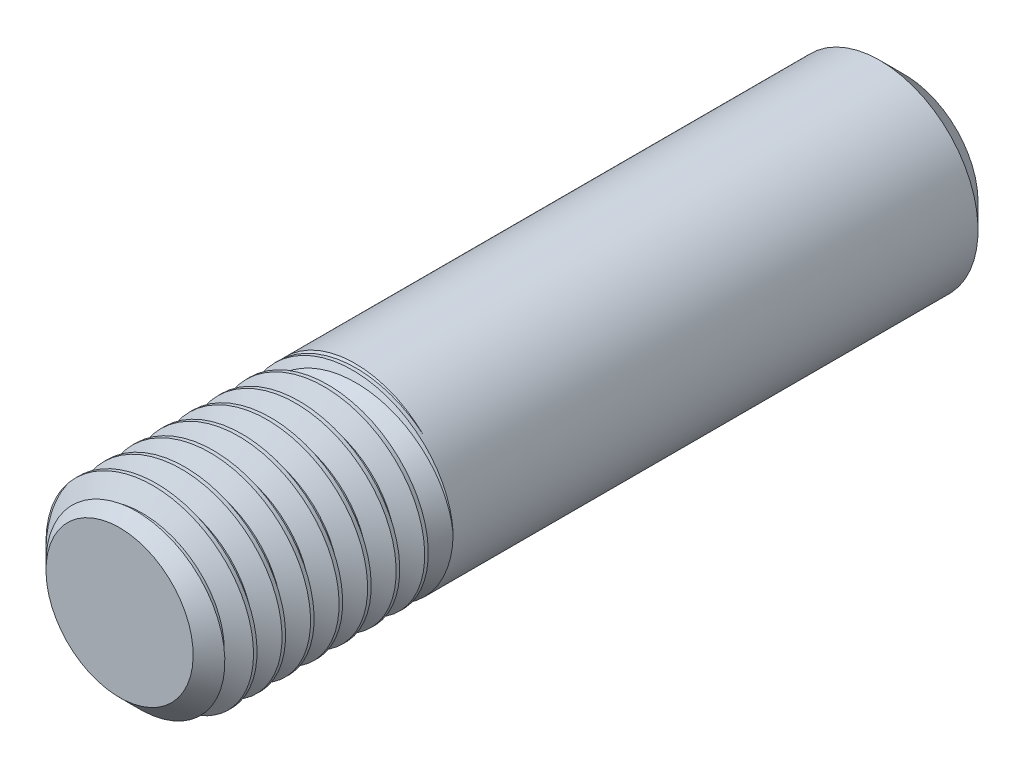
from build123d import *

# Parameters (mm, degrees)
CHAMFER1_SIZE          = 1.984375
CHAMFER2_SIZE          = 1.984375
CUT_SWEEP1_PITCH       = 2.309090909
CUT_SWEEP1_HEIGHT      = 21.359090909
CUT_SWEEP1_RADIUS      = 7.9375
CUT_SWEEP1_START_ANGLE = 90
SKETCH6_R              = 7.9375
BOSS_EXTRUDE1_DEPTH    = 19.05
BOSS_EXTRUDE1_TAPER    = 30


with BuildPart() as part:
    # Sketch3 → Revolve1 (revolve)
    with BuildSketch(Plane(origin=(0, 0, 0), x_dir=(0, 0, -1), z_dir=(1, 0, 0)), mode=Mode.PRIVATE) as revolve1_sk:
        Polygon((-31.75, 0), (31.75, 0), (31.75, 7.9375), (-12.7, 7.9375), (-31.75, 7.9375), align=None)
    revolve(revolve1_sk.sketch.rotate(Axis((0, 0, 31.75), (0, 0, -1)), 180), axis=Axis((0, 0, 31.75), (0, 0, -1)))

    # Chamfer1
    chamfer1_edges = [part.edges().sort_by_distance(p)[0] for p in [
        (0, 7.9375, 31.75),
    ]]
    chamfer(chamfer1_edges, length=CHAMFER1_SIZE)

    # Chamfer2
    chamfer2_edges = [part.edges().sort_by_distance(p)[0] for p in [
        (0, 7.9375, -31.75),
    ]]
    chamfer(chamfer2_edges, length=CHAMFER2_SIZE)


with BuildPart() as body_2:
    # Split1: the piece on the far side of the plane
    add(part.part)
    split(bisect_by=Plane.XY.offset(12.7), keep=Keep.BOTTOM)


with BuildPart() as part_1:
    add(part.part)

    # Split1
    split(bisect_by=Plane.XY.offset(12.7), keep=Keep.TOP)

    # Cut-Sweep1: sweep along a helix
    with BuildLine() as cut_sweep1_path:
        add(Helix(CUT_SWEEP1_PITCH, CUT_SWEEP1_HEIGHT, CUT_SWEEP1_RADIUS, center=(0, 0, 31.75), direction=(0, 0, -1), mode=Mode.PRIVATE).rotate(Axis((0, 0, 31.75), (0, 0, -1)), CUT_SWEEP1_START_ANGLE))
    # Sketch5 → Cut-Sweep1 (sweep, cut)
    with BuildSketch(Plane(origin=(0, 0, 0), x_dir=(0, 0, -1), z_dir=(1, 0, 0))):
        Polygon((-33.842613636, 8.062483212), (-31.677840909, 8.062483212), (-32.615909091, 6.43770146), (-32.904545455, 6.43770146), align=None)
    sweep(path=cut_sweep1_path.line, is_frenet=True, mode=Mode.SUBTRACT)

    add(body_2.part)  # Boss-Extrude1 merges body 2
    # Sketch6 → Boss-Extrude1 (add, through all)
    with BuildSketch(Plane.XY.offset(12.7)):
        with Locations(Location((0, 0, 0), (0, 0, 270))):
            Circle(SKETCH6_R)
    extrude(amount=BOSS_EXTRUDE1_DEPTH, taper=BOSS_EXTRUDE1_TAPER)


solid = part_1.part
